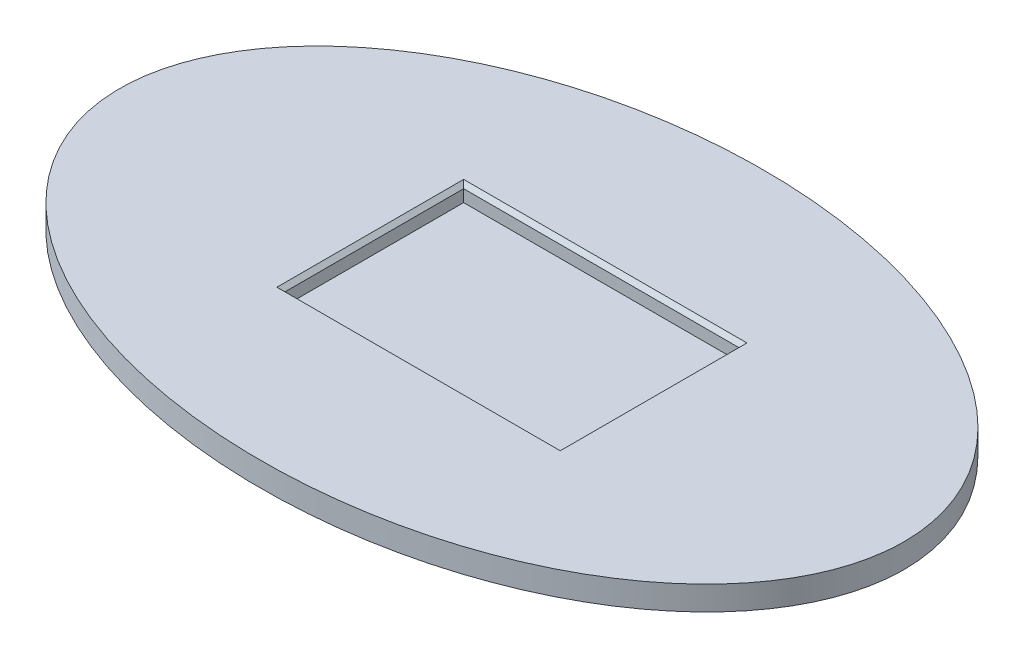
from build123d import *

# Parameters (mm, degrees)
SKETCH2_RX          = 97.5
SKETCH2_RY          = 62.5
BOSS_EXTRUDE1_DEPTH = 3
SKETCH3_W           = 68.4
SKETCH3_H           = 44.4
CUT_EXTRUDE1_DEPTH  = 4
CHAMFER2_SIZE       = 1


with BuildPart() as part:
    # Sketch2 → Boss-Extrude1 (new, symmetric)
    with BuildSketch(Plane(origin=(0, 0, 0), x_dir=(1, 0, 0), z_dir=(0, 1, 0))):
        with Locations((0, 0)):
            Ellipse(SKETCH2_RX, SKETCH2_RY)
    extrude(amount=BOSS_EXTRUDE1_DEPTH, both=True)

    # Sketch3 → Cut-Extrude1 (cut)
    with BuildSketch(Plane(origin=(0, 3, 0), x_dir=(1, 0, 0), z_dir=(0, 1, 0))):
        Rectangle(SKETCH3_W, SKETCH3_H)
    extrude(amount=-CUT_EXTRUDE1_DEPTH, mode=Mode.SUBTRACT)

    # Chamfer2
    chamfer2_edges = [part.edges().sort_by_distance(p)[0] for p in [
        (0, 3, 22.2),
        (34.2, 3, 0),
        (0, 3, -22.2),
        (-34.2, 3, 0),
    ]]
    chamfer(chamfer2_edges, length=CHAMFER2_SIZE)


solid = part.part
